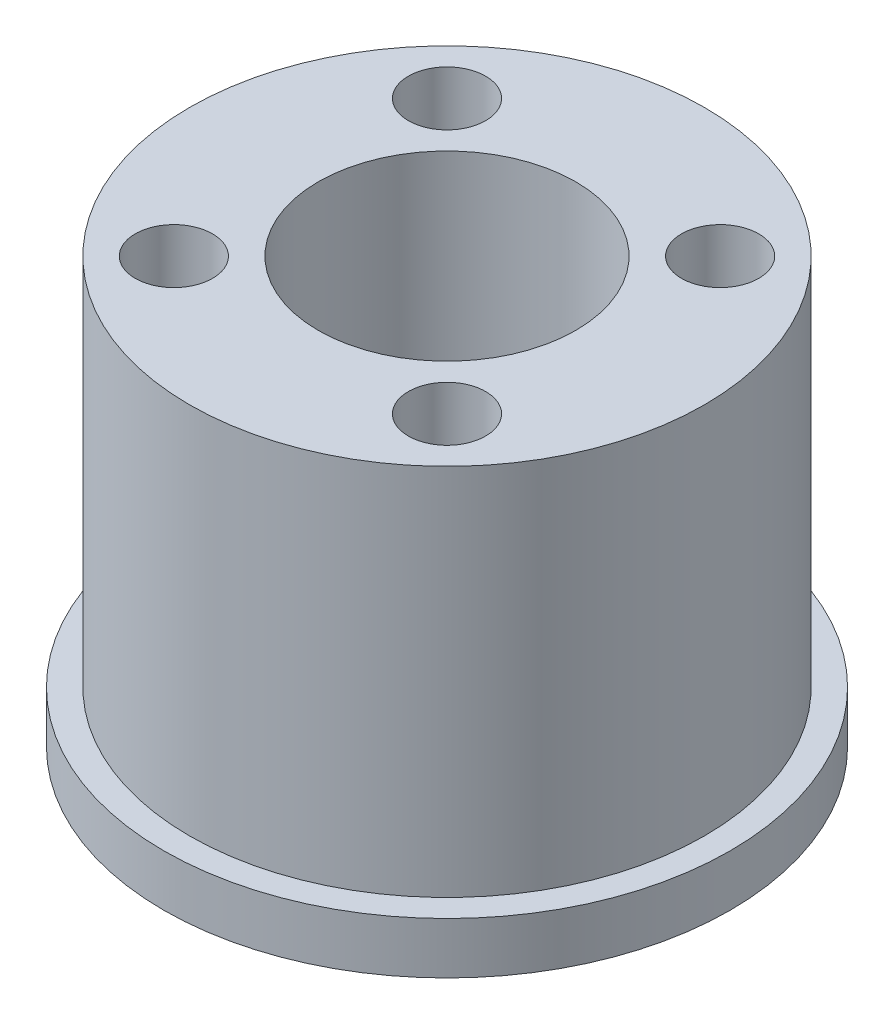
from build123d import *

# Parameters (mm, degrees)
SKETCH_1_W                = 11
SKETCH_1_H                = 2
SKETCH_2_R                = 10
EXTRUDE_1_DEPTH           = 14.5
HOLE_WIZARD_3_0_3_1_D     = 3
HOLE_WIZARD_3_0_3_1_DEPTH = 6
HOLE_WIZARD_10_0_10_1_D   = 10


with BuildPart() as part:
    # 草图1 → 旋转1 (revolve)
    with BuildSketch(Plane.XY, mode=Mode.PRIVATE) as revolve_1_sk:
        with Locations((5.5, 1)):
            Rectangle(SKETCH_1_W, SKETCH_1_H)
    revolve(revolve_1_sk.sketch.rotate(Axis((0, 2, 0), (0, -1, 0)), 270), axis=Axis((0, 2, 0), (0, -1, 0)))

    # 草图2 → 凸台-拉伸1 (add)
    with BuildSketch(Plane(origin=(0, 2, 0), x_dir=(-1, 0, 0), z_dir=(0, 1, 0))):
        with Locations(Location((0, 0, 0), (0, 0, 270))):
            Circle(SKETCH_2_R)
    extrude(amount=EXTRUDE_1_DEPTH)

    # Ø3.0 (3) 直径孔1
    with Locations(Plane(origin=(0, 16.5, 0), x_dir=(1, 0, 0), z_dir=(0, 1, 0))):
        with Locations((5.303300859, 5.303300859), (5.303300859, -5.303300859), (-5.303300859, -5.303300859), (-5.303300859, 5.303300859)):
            Hole(HOLE_WIZARD_3_0_3_1_D / 2, depth=HOLE_WIZARD_3_0_3_1_DEPTH)

    # Ø10.0 (10) 直径孔1 (through all)
    with Locations(Plane(origin=(0, 0, 0), x_dir=(-1, 0, 0), z_dir=(0, -1, 0))):
        with Locations((0, 0)):
            Hole(HOLE_WIZARD_10_0_10_1_D / 2)


solid = part.part
